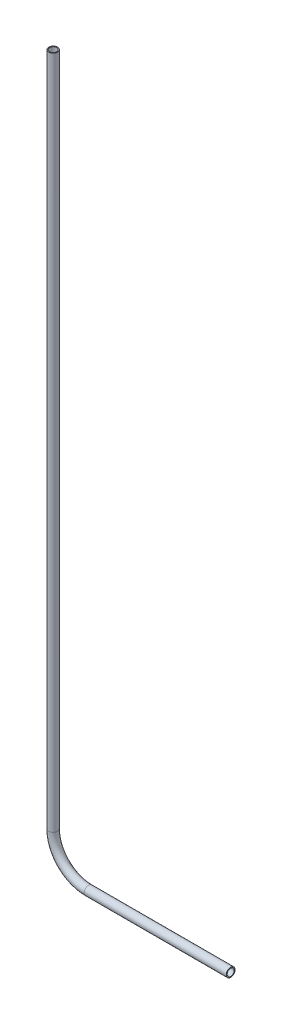
from build123d import *

# Parameters (mm, degrees)
SKETCH2_R   = 3.175
SKETCH2_R_2 = 2.54


with BuildPart() as part:
    # Sweep1: sweep along a path in Sketch1
    with BuildLine(Plane.XY) as sweep1_path:
        Line((0, -76.2), (0, -558.8))
        ThreePointArc((0, -558.8), (7.439487758, -576.760512242), (25.4, -584.2))
        Line((25.4, -584.2), (127, -584.2))
    # Sketch2 → Sweep1 (sweep)
    with BuildSketch(Plane(origin=(0, -76.2, 0), x_dir=(-1, 0, 0), z_dir=(0, -1, 0))):
        Circle(SKETCH2_R)
        Circle(SKETCH2_R_2, mode=Mode.SUBTRACT)
    sweep(path=sweep1_path.line)


solid = part.part
